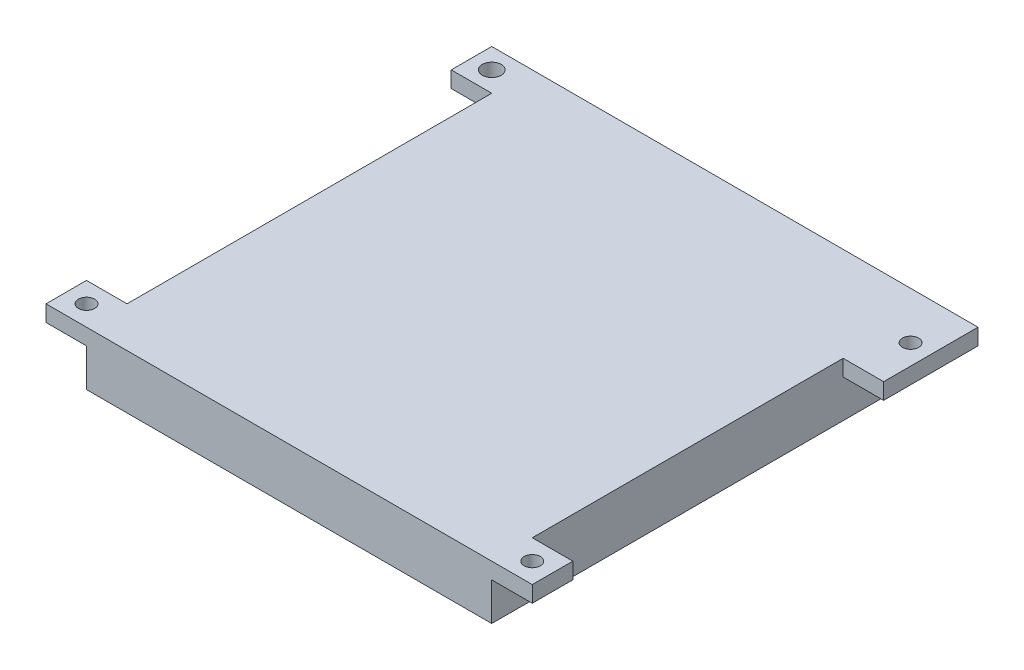
from build123d import *

# Parameters (mm, degrees)
SKETCH_1_W          = 150
SKETCH_1_H          = 165
EXTRUDE_1_DEPTH     = 20
SKETCH_2_W          = 15
SKETCH_2_H          = 15
SKETCH_2_R          = 3.5
SKETCH_2_H_2        = 34.926404716
SKETCH_2_R_2        = 3
EXTRUDE_2_DEPTH     = 6
SKETCH_4_R          = 3
CUT_EXTRUDE_1_DEPTH = 15


with BuildPart() as part:
    # Эскиз1 → Бобышка-Вытянуть1 (new body)
    with BuildSketch(Plane(origin=(0, 0, 0), x_dir=(1, 0, 0), z_dir=(0, 1, 0))):
        with Locations((124.999768599, -49.470063243)):
            Rectangle(SKETCH_1_W, SKETCH_1_H)
    extrude(amount=-EXTRUDE_1_DEPTH)

    # Эскиз2 → Бобышка-Вытянуть2 (add)
    # profile 1 of 4: a face of its own
    with BuildSketch(Plane(origin=(0, 0, 0), x_dir=(1, 0, 0), z_dir=(0, 1, 0))):
        with Locations((42.499768599, 25.529936757)):
            Rectangle(SKETCH_2_W, SKETCH_2_H)
        with Locations(Location((42.499768599, 25.529936757, 0), (0, 0, 270))):
            Circle(SKETCH_2_R, mode=Mode.SUBTRACT)
    # profile 2 of 4: a face of its own
    with BuildSketch(Plane(origin=(0, 0, 0), x_dir=(1, 0, 0), z_dir=(0, 1, 0))):
        with Locations((207.499768599, 15.566734399)):
            Rectangle(SKETCH_2_W, SKETCH_2_H_2)
        with Locations(Location((207.499768599, 15.566734399, 0), (0, 0, 270))):
            Circle(SKETCH_2_R_2, mode=Mode.SUBTRACT)
    # profile 3 of 4: a face of its own
    with BuildSketch(Plane(origin=(0, 0, 0), x_dir=(1, 0, 0), z_dir=(0, 1, 0))):
        with Locations((207.499768599, -124.470063243)):
            Rectangle(SKETCH_2_W, SKETCH_2_H)
        with Locations(Location((207.499768599, -124.470063243, 0), (0, 0, 270))):
            Circle(SKETCH_2_R_2, mode=Mode.SUBTRACT)
    # profile 4 of 4: a face of its own
    with BuildSketch(Plane(origin=(0, 0, 0), x_dir=(1, 0, 0), z_dir=(0, 1, 0))):
        with Locations((42.499768599, -124.470063243)):
            Rectangle(SKETCH_2_W, SKETCH_2_H)
        with Locations(Location((42.499768599, -124.470063243, 0), (0, 0, 270))):
            Circle(SKETCH_2_R_2, mode=Mode.SUBTRACT)
    extrude(amount=-EXTRUDE_2_DEPTH)

    # Эскиз4 → Вырез-Вытянуть1 (cut)
    with BuildSketch(Plane.XZ.offset(20)):
        with Locations(Location((163.836550468, 77.190523299, 0), (0, 0, 270))):
            Circle(SKETCH_4_R)
        with Locations(Location((142.578381334, -20.523806485, 0), (0, 0, 270))):
            Circle(SKETCH_4_R)
        with Locations(Location((68.584373995, 46.743472914, 0), (0, 0, 270))):
            Circle(SKETCH_4_R)
    extrude(amount=-CUT_EXTRUDE_1_DEPTH, mode=Mode.SUBTRACT)


solid = part.part
